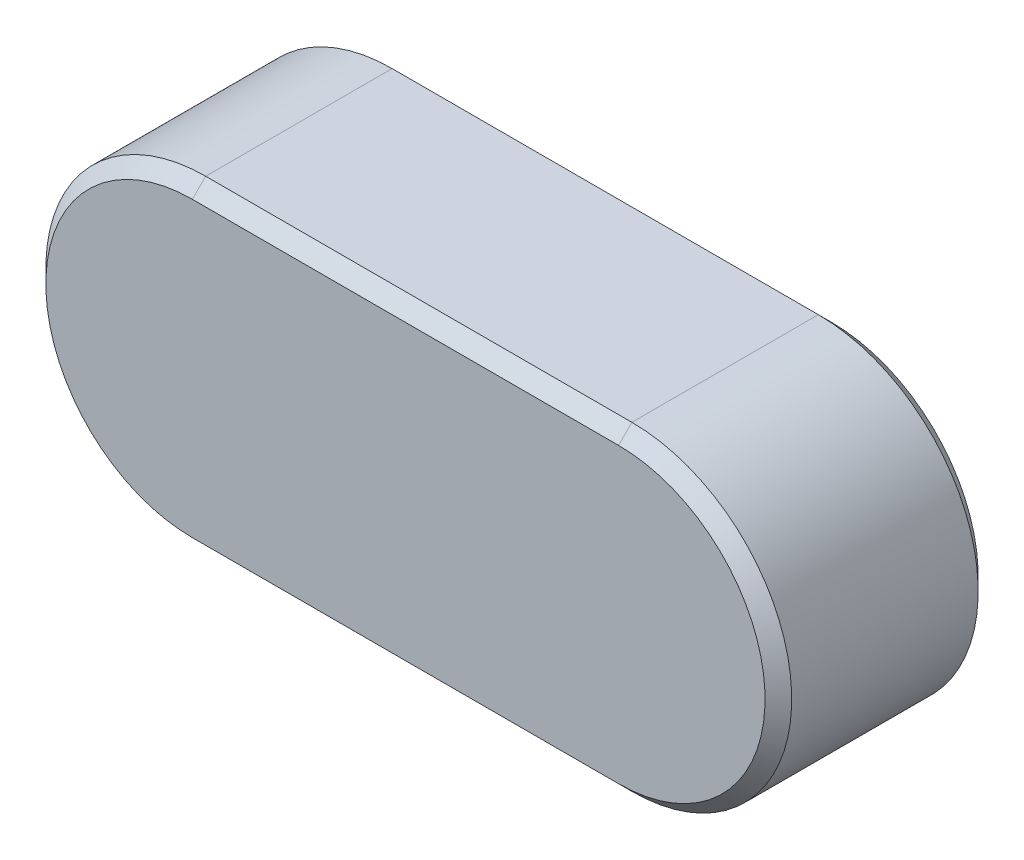
from build123d import *

# Parameters (mm, degrees)
EXTRUDE1_DEPTH = 4
CHAMFER1_SIZE  = 0.25


with BuildPart() as part:
    # Sketch1 → Extrude1 (new body)
    with BuildSketch(Plane.XY):
        with BuildLine():
            Line((0, 3), (-8, 3))
            ThreePointArc((-8, 3), (-11, 0), (-8, -3))
            Line((-8, -3), (0, -3))
            ThreePointArc((0, -3), (3, 0), (0, 3))
        make_face()
    extrude(amount=EXTRUDE1_DEPTH)

    # Chamfer1
    chamfer1_edges = [part.edges().sort_by_distance(p)[0] for p in [
        (-11, 0, 4),
        (-4, -3, 4),
        (3, 0, 4),
        (-4, -3, 0),
        (-11, 0, 0),
        (-4, 3, 0),
        (3, 0, 0),
        (-4, 3, 4),
    ]]
    chamfer(chamfer1_edges, length=CHAMFER1_SIZE)


solid = part.part
